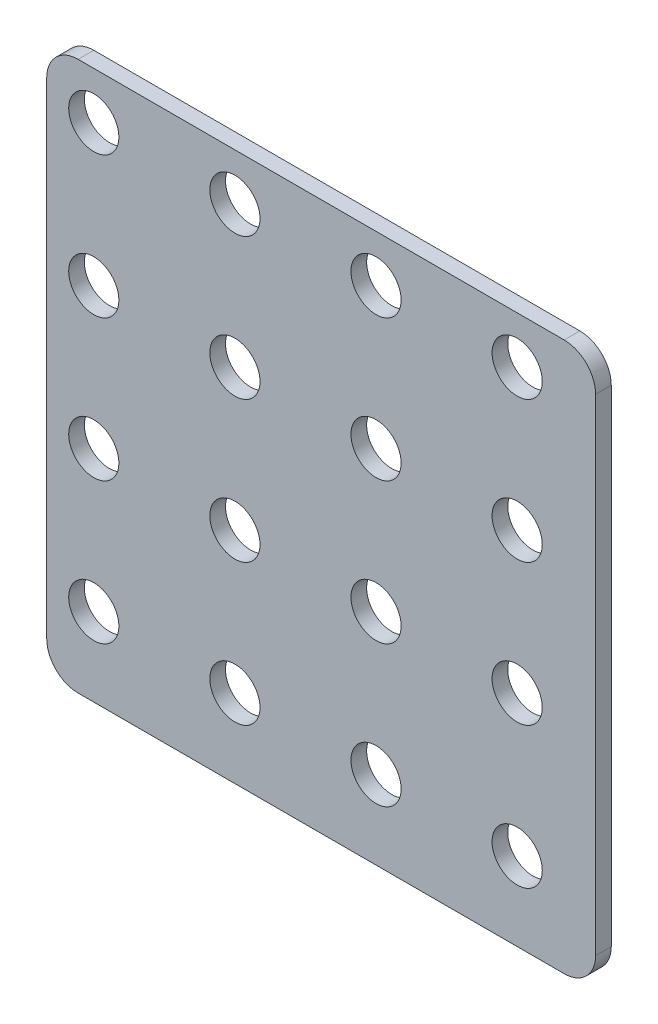
from build123d import *

# Parameters (mm, degrees)
SKETCH1_W            = 35
SKETCH1_H            = 35
BOSS_EXTRUDE1_DEPTH  = 1
SKETCH2_R            = 1.6
CUT_EXTRUDE1_DEPTH   = 50.507575178
LPATTERN1_COUNT      = 4
LPATTERN1_PITCH      = 9
LPATTERN1_COUNT_DIR2 = 4
LPATTERN1_PITCH_DIR2 = 9
FILLET1_R            = 2


with BuildPart() as part:
    # Sketch1 → Boss-Extrude1 (new body)
    with BuildSketch(Plane.XY):
        with Locations((17.5, 17.5)):
            Rectangle(SKETCH1_W, SKETCH1_H)
    extrude(amount=BOSS_EXTRUDE1_DEPTH)

    # Sketch2 → Cut-Extrude1 (cut, symmetric)
    with BuildSketch(Plane.XY.offset(1)):
        with Locations((3, 32)):
            Circle(SKETCH2_R)
    cut_extrude1 = extrude(amount=CUT_EXTRUDE1_DEPTH, both=True, mode=Mode.SUBTRACT)

    # LPattern1: Cut-Extrude1 4 × 4
    with Locations(*[(i * LPATTERN1_PITCH, -j * LPATTERN1_PITCH_DIR2, 0) for i in range(LPATTERN1_COUNT) for j in range(LPATTERN1_COUNT_DIR2) if (i, j) != (0, 0)]):
        add(cut_extrude1, mode=Mode.SUBTRACT)

    # Fillet1
    fillet1_edges = [part.edges().sort_by_distance(p)[0] for p in [
        (0, 35, 0.5),
        (35, 35, 0.5),
        (35, 0, 0.5),
        (0, 0, 0.5),
    ]]
    fillet(fillet1_edges, radius=FILLET1_R)


solid = part.part
